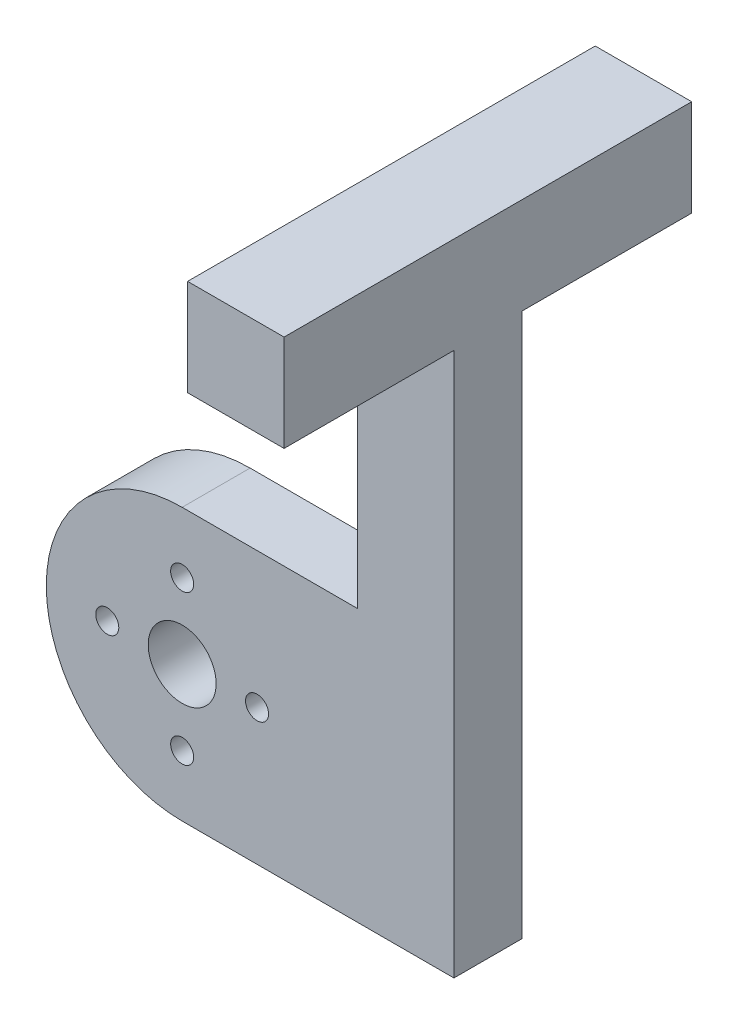
from build123d import *

# Parameters (mm, degrees)
SKETCH2_R           = 12.7
SKETCH2_R_2         = 1.077000005
BOSS_EXTRUDE1_DEPTH = 3.175
SKETCH3_W           = 9.017
SKETCH3_H           = 9.017
BOSS_EXTRUDE2_DEPTH = 19.05
SKETCH4_R           = 3.175
CUT_EXTRUDE1_DEPTH  = 58.957935729


with BuildPart() as part:
    # Sketch2 → Boss-Extrude1 (new, symmetric)
    # profile 1 of 2: a face of its own
    with BuildSketch(Plane.XY):
        with BuildLine():
            Line((25.4, 47.117), (16.383, 47.117))
            Line((16.383, 47.117), (16.383, 12.7))
            Line((16.383, 12.7), (0, 12.7))
            ThreePointArc((0, 12.7), (8.980256121, 8.980256121), (12.7, 0))
            ThreePointArc((12.7, 0), (8.980256121, -8.980256121), (0, -12.7))
            Line((0, -12.7), (25.4, -12.7))
            Line((25.4, -12.7), (25.4, 47.117))
        make_face()
    # profile 2 of 2: a face of its own
    with BuildSketch(Plane.XY):
        Circle(SKETCH2_R)
        with Locations((0, 6.99999997)):
            Circle(SKETCH2_R_2, mode=Mode.SUBTRACT)
        with Locations((-6.99999997, 0)):
            Circle(SKETCH2_R_2, mode=Mode.SUBTRACT)
        with Locations((0, -6.99999997)):
            Circle(SKETCH2_R_2, mode=Mode.SUBTRACT)
        with Locations((6.99999997, 0)):
            Circle(SKETCH2_R_2, mode=Mode.SUBTRACT)
    extrude(amount=BOSS_EXTRUDE1_DEPTH, both=True)

    # Sketch3 → Boss-Extrude2 (add, symmetric)
    with BuildSketch(Plane(origin=(0, 0, 0), x_dir=(-1, 0, 0), z_dir=(0, 0, -1))):
        with Locations((-20.8915, 42.6085)):
            Rectangle(SKETCH3_W, SKETCH3_H)
    extrude(amount=BOSS_EXTRUDE2_DEPTH, both=True)

    # Sketch4 → Cut-Extrude1 (cut, through all)
    with BuildSketch(Plane.XY.offset(3.175)):
        Circle(SKETCH4_R)
    extrude(amount=-CUT_EXTRUDE1_DEPTH, mode=Mode.SUBTRACT)


solid = part.part
